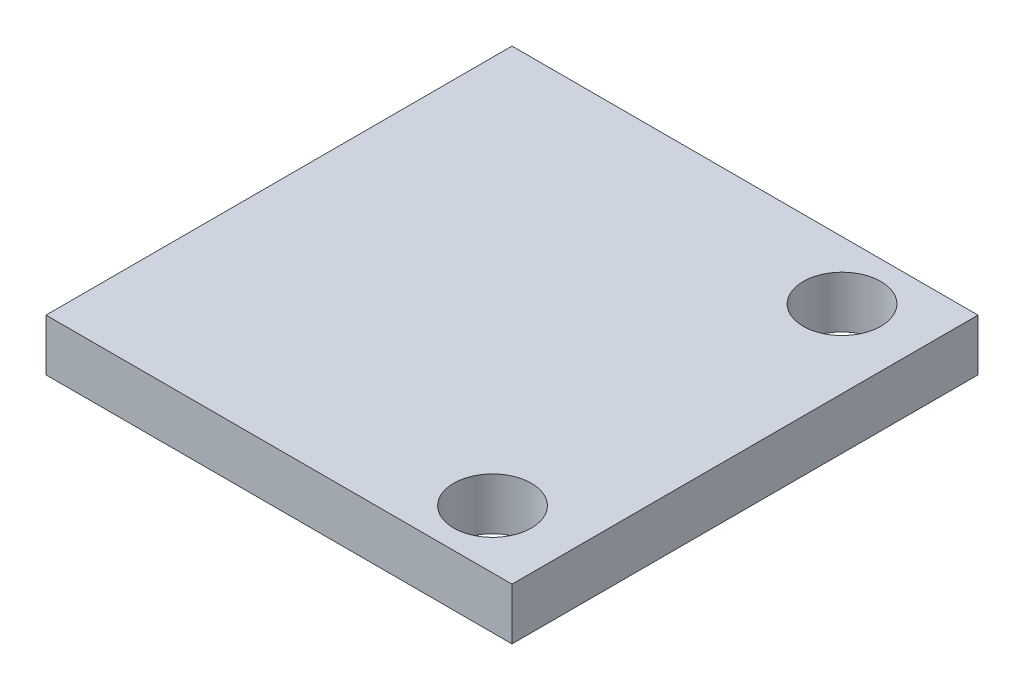
from build123d import *

# Parameters (mm, degrees)
SKETCH1_W           = 18
SKETCH1_H           = 18
BOSS_EXTRUDE1_DEPTH = 2
SKETCH2_R           = 1.5
CUT_EXTRUDE1_DEPTH  = 26.66920678


with BuildPart() as part:
    # Sketch1 → Boss-Extrude1 (new body)
    with BuildSketch(Plane(origin=(0, 0, 0), x_dir=(1, 0, 0), z_dir=(0, 1, 0))):
        with Locations((14.469164691, -1.203258568)):
            Rectangle(SKETCH1_W, SKETCH1_H)
    extrude(amount=BOSS_EXTRUDE1_DEPTH)

    # Sketch2 → Cut-Extrude1 (cut, through all)
    with BuildSketch(Plane(origin=(0, 2, 0), x_dir=(1, 0, 0), z_dir=(0, 1, 0))):
        with Locations(Location((20.46738691, 5.546741432, 0), (0, 0, 270))):
            Circle(SKETCH2_R)
        with Locations(Location((20.46738691, -7.953258568, 0), (0, 0, 270))):
            Circle(SKETCH2_R)
    extrude(amount=-CUT_EXTRUDE1_DEPTH, mode=Mode.SUBTRACT)


solid = part.part
